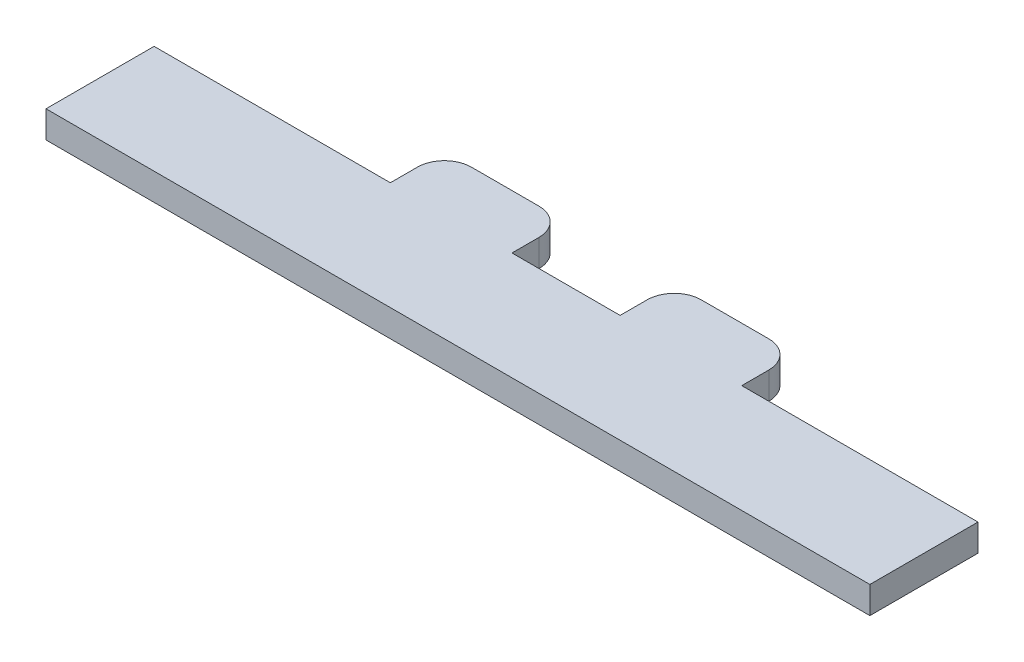
from build123d import *

# Parameters (mm, degrees)
SKETCH1_W           = 45
SKETCH1_H           = 20
SKETCH1_W_2         = 304.8
SKETCH1_H_2         = 40
BOSS_EXTRUDE1_DEPTH = 10
FILLET1_R           = 10


with BuildPart() as part:
    # Sketch1 → Boss-Extrude1 (new body)
    with BuildSketch(Plane(origin=(0, 0, 0), x_dir=(1, 0, 0), z_dir=(0, 1, 0))):
        with Locations((-42.5, 30)):
            Rectangle(SKETCH1_W, SKETCH1_H)
        with Locations((42.5, 30)):
            Rectangle(SKETCH1_W, SKETCH1_H)
        Rectangle(SKETCH1_W_2, SKETCH1_H_2)
    extrude(amount=BOSS_EXTRUDE1_DEPTH)

    # Fillet1
    fillet1_edges = [part.edges().sort_by_distance(p)[0] for p in [
        (-20, 5, -40),
        (20, 5, -40),
        (65, 5, -40),
        (-65, 5, -40),
    ]]
    fillet(fillet1_edges, radius=FILLET1_R)


solid = part.part
